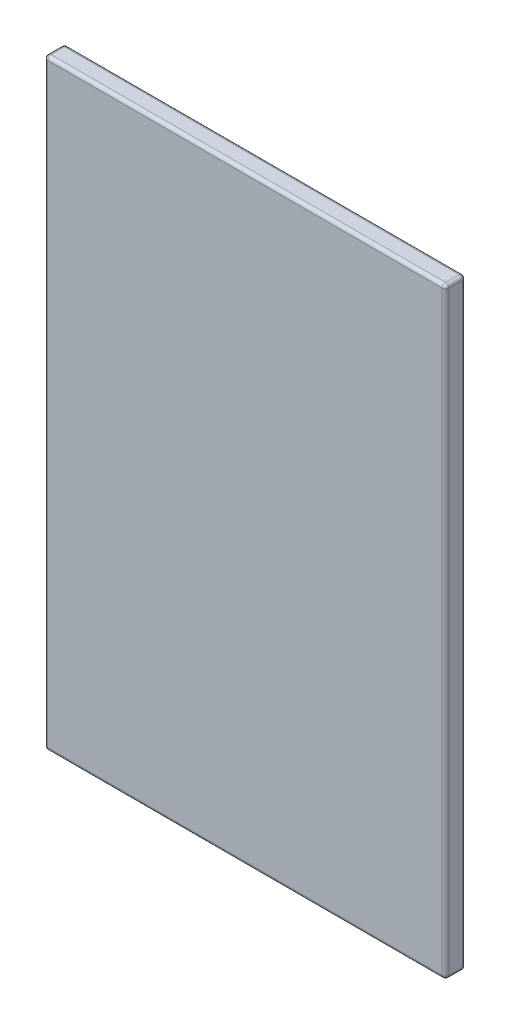
from build123d import *

# Parameters (mm, degrees)
SKETCH_1_W      = 60
SKETCH_1_H      = 90
EXTRUDE_1_DEPTH = 3
FILLET_1_R      = 0.5


with BuildPart() as part:
    # 草图1 → 凸台-拉伸1 (new body)
    with BuildSketch(Plane.XY):
        Rectangle(SKETCH_1_W, SKETCH_1_H)
    extrude(amount=EXTRUDE_1_DEPTH)

    # 圆角1
    fillet_1_edges = [part.edges().sort_by_distance(p)[0] for p in [
        (30, 0, 3),
        (0, 45, 3),
        (-30, 0, 3),
        (0, 45, 0),
        (30, 0, 0),
        (0, -45, 0),
        (-30, 0, 0),
        (0, -45, 3),
        (-30, 45, 1.5),
        (30, 45, 1.5),
        (30, -45, 1.5),
        (-30, -45, 1.5),
    ]]
    fillet(fillet_1_edges, radius=FILLET_1_R)


solid = part.part
